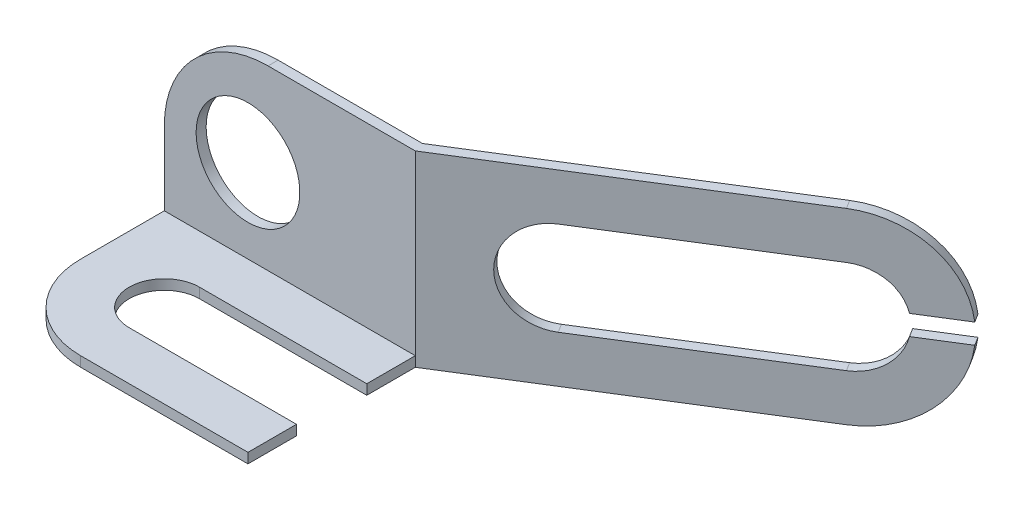
from build123d import *

# Parameters (mm, degrees)
BOSS_EXTRUDE1_DEPTH = 0.06
SKETCH3_R           = 0.31
BOSS_EXTRUDE2_DEPTH = 0.06
BOSS_EXTRUDE3_DEPTH = 0.06


with BuildPart() as part:
    # Sketch1 → Boss-Extrude1 (new body)
    with BuildSketch(Plane(origin=(0, 0, 0), x_dir=(1, 0, 0), z_dir=(0, 1, 0))):
        with BuildLine():
            Line((-0.75, 0.5), (0.75, 0.5))
            Line((0.75, 0.5), (0.75, 0.21))
            Line((0.75, 0.21), (-0.25, 0.21))
            ThreePointArc((-0.25, 0.21), (-0.46, 0), (-0.25, -0.21))
            Line((-0.25, -0.21), (0.75, -0.21))
            Line((0.75, -0.21), (0.75, -0.5))
            Line((0.75, -0.5), (-0.25, -0.5))
            ThreePointArc((-0.25, -0.5), (-0.603553391, -0.353553391), (-0.75, 0))
            Line((-0.75, 0), (-0.75, 0.5))
        make_face()
    extrude(amount=BOSS_EXTRUDE1_DEPTH)

    # Sketch3 → Boss-Extrude2 (add)
    with BuildSketch(Plane(origin=(0, 0, -0.5), x_dir=(-1, 0, 0), z_dir=(0, 0, -1))):
        with BuildLine():
            Line((-0.75, 0), (0.75, 0))
            Line((0.75, 0), (0.75, 0.5))
            ThreePointArc((0.75, 0.5), (0.568406204, 0.938406204), (0.13, 1.12))
            Line((0.13, 1.12), (-0.75, 1.12))
            Line((-0.75, 1.12), (-0.75, 0))
        make_face()
        with Locations((0.25, 0.56)):
            Circle(SKETCH3_R, mode=Mode.SUBTRACT)
    extrude(amount=BOSS_EXTRUDE2_DEPTH)

    # Sketch6 → Boss-Extrude3 (add)
    with BuildSketch(Plane(origin=(-0.014087692, 0, -0.022545019), x_dir=(-0.8480480961564253, 0, 0.529919264233206), z_dir=(-0.529919264233206, 0, -0.8480480961564253))):
        with BuildLine():
            Line((-0.900995704, 1.12), (-2.770995704, 1.12))
            ThreePointArc((-2.770995704, 1.12), (-3.145161443, 0.976653333), (-3.327772141, 0.62))
            Line((-3.327772141, 0.62), (-3.044491591, 0.62))
            ThreePointArc((-3.044491591, 0.62), (-2.946494992, 0.778174242), (-2.770995704, 0.84))
            Line((-2.770995704, 0.84), (-1.520995704, 0.84))
            ThreePointArc((-1.520995704, 0.84), (-1.240995704, 0.56), (-1.520995704, 0.28))
            Line((-1.520995704, 0.28), (-2.770995704, 0.28))
            ThreePointArc((-2.770995704, 0.28), (-2.946494992, 0.341825758), (-3.044491591, 0.5))
            Line((-3.044491591, 0.5), (-3.327772141, 0.5))
            ThreePointArc((-3.327772141, 0.5), (-3.145161443, 0.143346667), (-2.770995704, 0))
            Line((-2.770995704, 0), (-0.900995704, 0))
            Line((-0.900995704, 0), (-0.900995704, 1.12))
        make_face()
    extrude(amount=BOSS_EXTRUDE3_DEPTH)


solid = part.part
